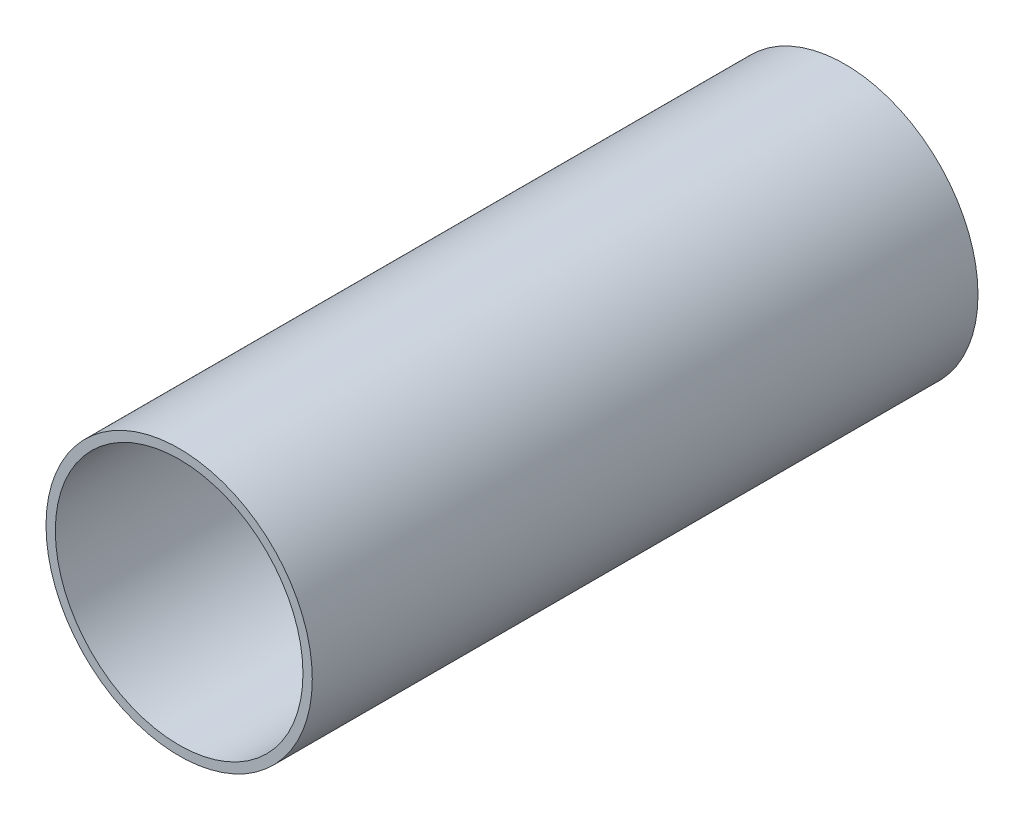
from build123d import *

# Parameters (mm, degrees)
SKETCH1_R           = 12.7
SKETCH1_R_2         = 11.811
BOSS_EXTRUDE1_DEPTH = 31.75


with BuildPart() as part:
    # Sketch1 → Boss-Extrude1 (new, symmetric)
    with BuildSketch(Plane.XY):
        Circle(SKETCH1_R)
        Circle(SKETCH1_R_2, mode=Mode.SUBTRACT)
    extrude(amount=BOSS_EXTRUDE1_DEPTH, both=True)


solid = part.part
